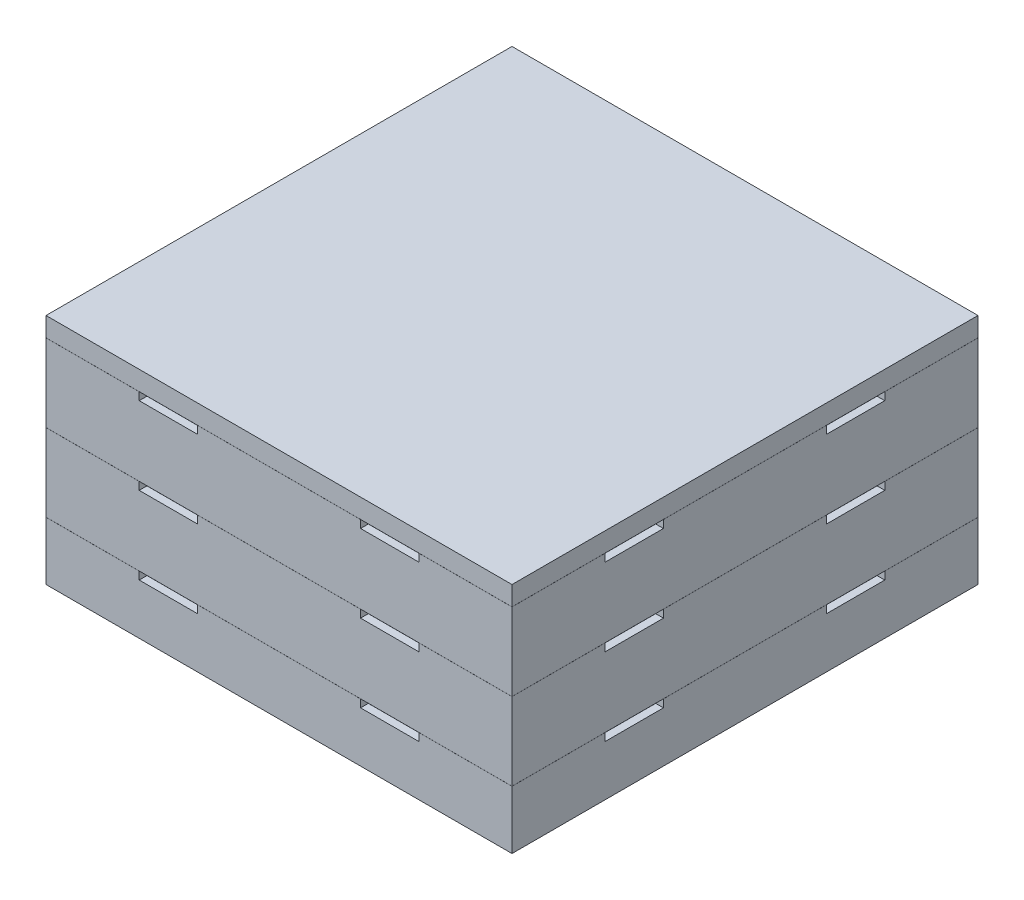
from build123d import *

# Parameters (mm, degrees)
SKETCH_1_W             = 600
SKETCH_1_H             = 600
EXTRUDE_1_DEPTH        = 600
CUT_EXTRUDE_1_DEPTH    = 20
CUT_EXTRUDE_2_DEPTH    = 20
PATTERN_LINEAR_1_COUNT = 3
PATTERN_LINEAR_1_PITCH = 200


with BuildPart() as part:
    # 草图1 → 凸台-拉伸1 (new body)
    with BuildSketch(Plane(origin=(0, 0, 0), x_dir=(1, 0, 0), z_dir=(0, 1, 0))):
        with Locations((-300, -300)):
            Rectangle(SKETCH_1_W, SKETCH_1_H)
    extrude(amount=EXTRUDE_1_DEPTH)

    # 草图2 → 切除-拉伸1 (cut)
    with BuildSketch(Plane.ZY.offset(600)):
        Polygon((600, 150.2), (0, 150.2), (0, 150), (210, 150), (210, 130), (360, 130), (360, 150), (600, 150), align=None)
    cut_extrude_1 = extrude(amount=-CUT_EXTRUDE_1_DEPTH, mode=Mode.SUBTRACT)

    # 草图3 → 切除-拉伸2 (cut)
    with BuildSketch(Plane.XY.offset(600)):
        Polygon((-580, 150.2), (-580, 150), (-360, 150), (-360, 130), (-210, 130), (-210, 150), (0, 150), (0, 150.2), align=None)
    cut_extrude_2 = extrude(amount=-CUT_EXTRUDE_2_DEPTH, mode=Mode.SUBTRACT)

    # 阵列(线性)1: 切除-拉伸1, 切除-拉伸2 ×3
    with Locations(*[(0, i * PATTERN_LINEAR_1_PITCH, 0) for i in range(1, PATTERN_LINEAR_1_COUNT)]):
        add(cut_extrude_1, mode=Mode.SUBTRACT)
        add(cut_extrude_2, mode=Mode.SUBTRACT)

    # 镜向1: part across plane


with BuildPart() as part_1:
    add(part.part)
    add(part.part.mirror(Plane(origin=(0, 600, 0), x_dir=(1, 0, 0), z_dir=(0, 0, 1))))

    # 镜向2: part across plane


with BuildPart() as part_2:
    add(part_1.part)
    add(part_1.part.mirror(Plane(origin=(0, 600, 0), x_dir=(0, 0, 1), z_dir=(-1, 0, 0))))


solid = part_2.part
